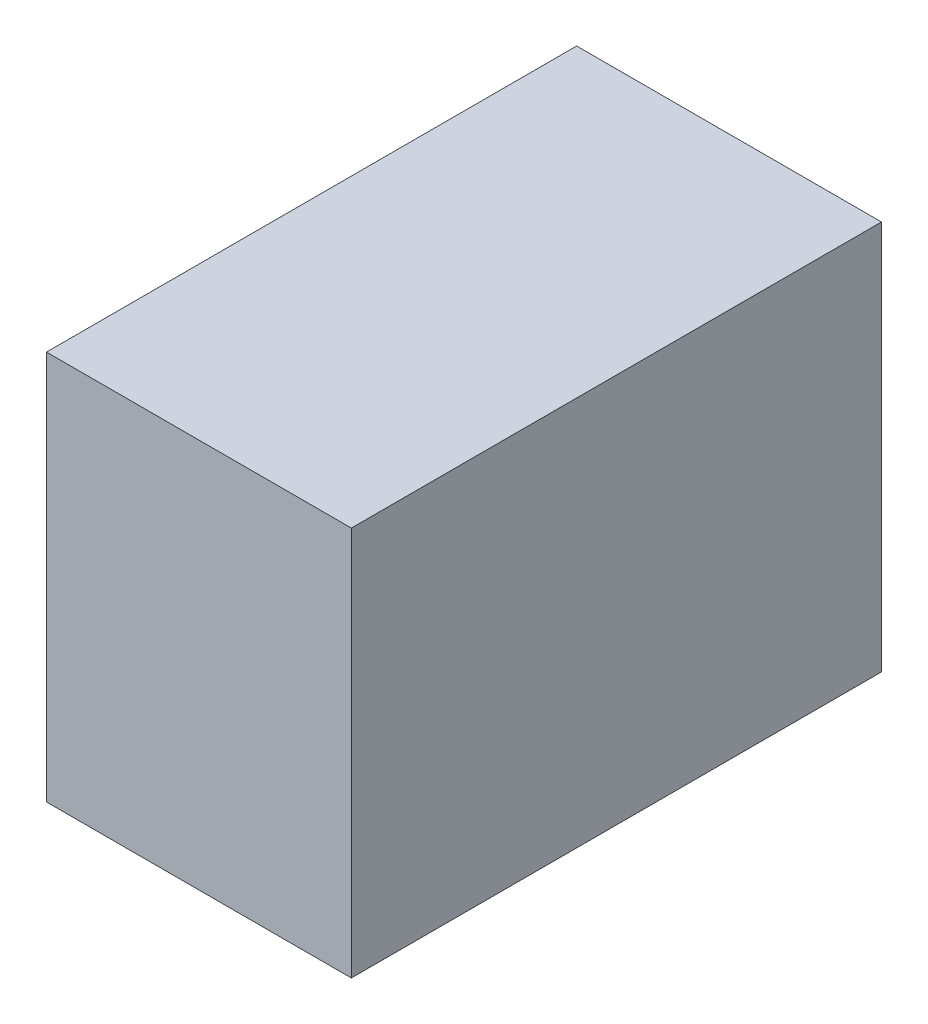
from build123d import *

# Parameters (mm, degrees)
SKETCH2_W           = 5.75
SKETCH2_H           = 7.35
BOSS_EXTRUDE1_DEPTH = 10


with BuildPart() as part:
    # Sketch2 → Boss-Extrude1 (new body)
    with BuildSketch(Plane.XY):
        Rectangle(SKETCH2_W, SKETCH2_H)
    extrude(amount=BOSS_EXTRUDE1_DEPTH)


solid = part.part
